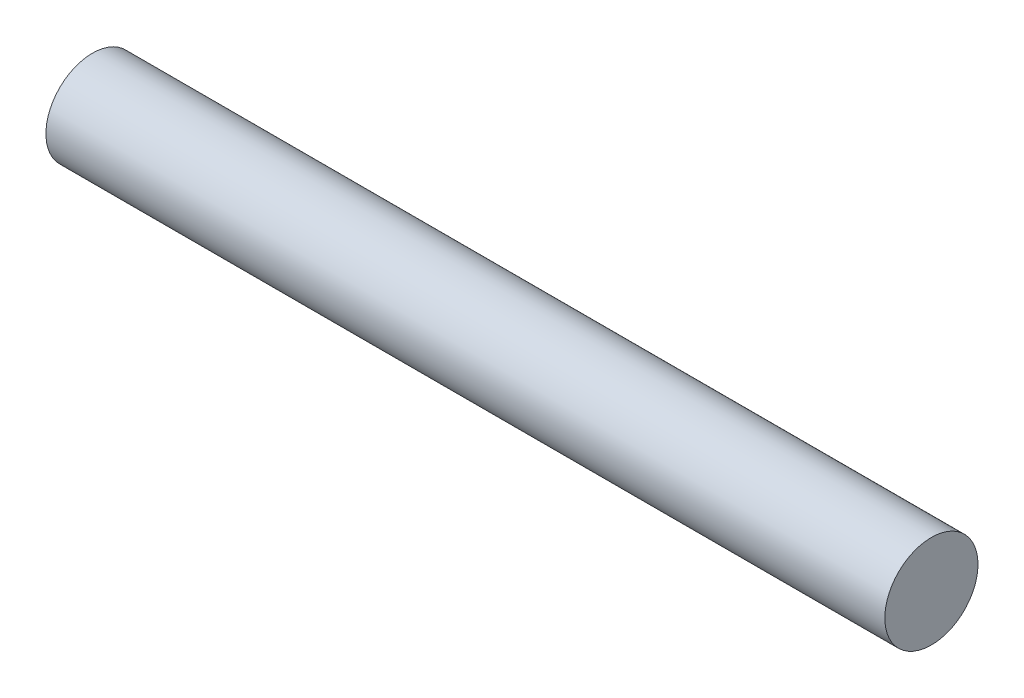
from build123d import *

# Parameters (mm, degrees)
SKETCH1_R           = 3.175
BOSS_EXTRUDE1_DEPTH = 57.15


with BuildPart() as part:
    # Sketch1 → Boss-Extrude1 (new body)
    with BuildSketch(Plane(origin=(0, 0, 0), x_dir=(0, 0, -1), z_dir=(1, 0, 0))):
        Circle(SKETCH1_R)
    extrude(amount=BOSS_EXTRUDE1_DEPTH)


solid = part.part
